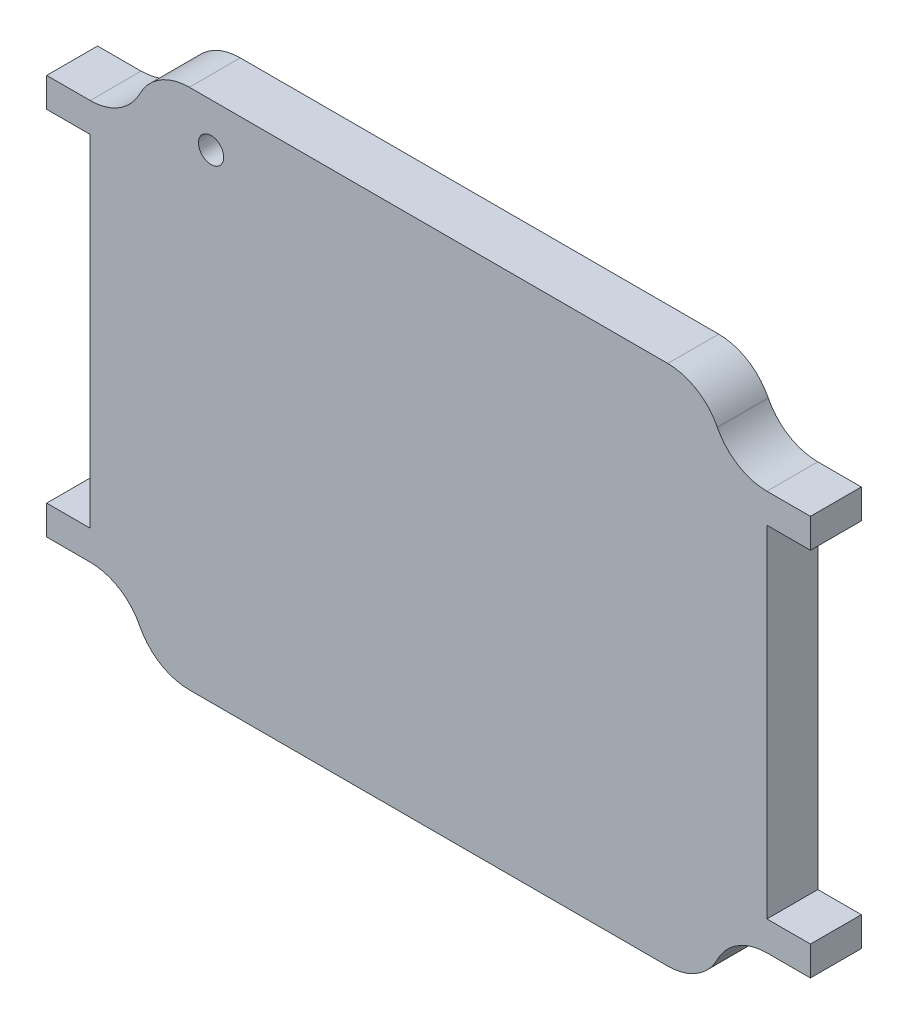
from build123d import *

# Parameters (mm, degrees)
SKETCH1_R           = 1.45
BOSS_EXTRUDE1_DEPTH = 5.85


with BuildPart() as part:
    # Sketch1 → Boss-Extrude1 (new body)
    with BuildSketch(Plane.XY):
        with BuildLine():
            Line((-38.9, 19.6), (-38.9, -19.6))
            Line((-38.9, -19.6), (-43.9, -19.6))
            Line((-43.9, -19.6), (-43.9, -22.98))
            Line((-43.9, -22.98), (-38.9, -22.98))
            ThreePointArc((-38.9, -22.98), (-35.552982671, -23.927877842), (-33.2, -26.49))
            ThreePointArc((-33.2, -26.49), (-30.847017329, -29.052122158), (-27.5, -30))
            Line((-27.5, -30), (27.5, -30))
            ThreePointArc((27.5, -30), (30.847017329, -29.052122158), (33.2, -26.49))
            ThreePointArc((33.2, -26.49), (35.552982671, -23.927877842), (38.9, -22.98))
            Line((38.9, -22.98), (43.9, -22.98))
            Line((43.9, -22.98), (43.9, -19.6))
            Line((43.9, -19.6), (38.9, -19.6))
            Line((38.9, -19.6), (38.9, 19.6))
            Line((38.9, 19.6), (43.9, 19.6))
            Line((43.9, 19.6), (43.9, 22.98))
            Line((43.9, 22.98), (38.9, 22.98))
            ThreePointArc((38.9, 22.98), (35.552982671, 23.927877842), (33.2, 26.49))
            ThreePointArc((33.2, 26.49), (30.847017329, 29.052122158), (27.5, 30))
            Line((27.5, 30), (-27.5, 30))
            ThreePointArc((-27.5, 30), (-30.847017329, 29.052122158), (-33.2, 26.49))
            ThreePointArc((-33.2, 26.49), (-35.552982671, 23.927877842), (-38.9, 22.98))
            Line((-38.9, 22.98), (-43.9, 22.98))
            Line((-43.9, 22.98), (-43.9, 19.6))
            Line((-43.9, 19.6), (-38.9, 19.6))
        make_face()
        with Locations((-25, 25)):
            Circle(SKETCH1_R, mode=Mode.SUBTRACT)
    extrude(amount=BOSS_EXTRUDE1_DEPTH)


solid = part.part
